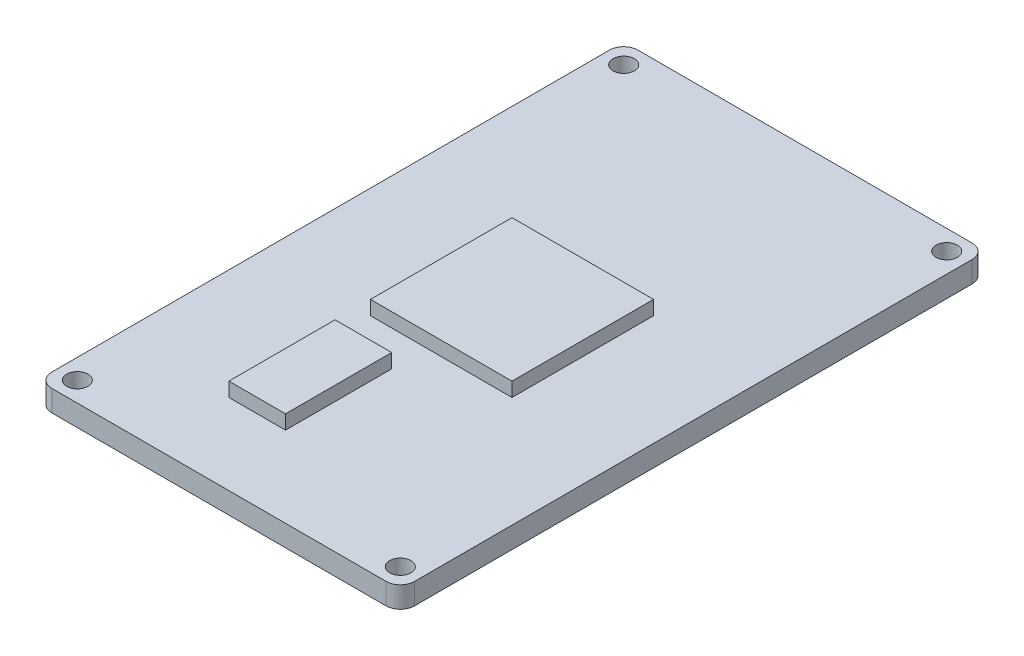
from build123d import *

# Parameters (mm, degrees)
SKETCH_1_W      = 51.24
SKETCH_1_H      = 82.8
SKETCH_1_R      = 1.5
EXTRUDE_1_DEPTH = 3
SKETCH_2_W      = 20
SKETCH_2_H      = 20
SKETCH_2_W_2    = 8
SKETCH_2_H_2    = 15
EXTRUDE_2_DEPTH = 2
FILLET_1_R      = 2


with BuildPart() as part:
    # 草图1 → 凸台-拉伸1 (new body)
    with BuildSketch(Plane(origin=(0, 0, 0), x_dir=(1, 0, 0), z_dir=(0, 1, 0))):
        Rectangle(SKETCH_1_W, SKETCH_1_H)
        with Locations(Location((22.82, 38.6, 0), (0, 0, 270))):
            Circle(SKETCH_1_R, mode=Mode.SUBTRACT)
        with Locations(Location((-22.82, 38.6, 0), (0, 0, 90))):
            Circle(SKETCH_1_R, mode=Mode.SUBTRACT)
        with Locations(Location((-22.82, -38.6, 0), (0, 0, 270))):
            Circle(SKETCH_1_R, mode=Mode.SUBTRACT)
        with Locations(Location((22.82, -38.6, 0), (0, 0, 90))):
            Circle(SKETCH_1_R, mode=Mode.SUBTRACT)
    extrude(amount=EXTRUDE_1_DEPTH)

    # 草图2 → 凸台-拉伸2 (add)
    with BuildSketch(Plane(origin=(0, 3, 0), x_dir=(1, 0, 0), z_dir=(0, 1, 0))):
        Rectangle(SKETCH_2_W, SKETCH_2_H)
        with Locations((-6, -22.5)):
            Rectangle(SKETCH_2_W_2, SKETCH_2_H_2)
    extrude(amount=EXTRUDE_2_DEPTH)

    # 圆角1
    fillet_1_edges = [part.edges().sort_by_distance(p)[0] for p in [
        (-25.62, 1.5, 41.4),
        (-25.62, 1.5, -41.4),
        (25.62, 1.5, -41.4),
        (25.62, 1.5, 41.4),
    ]]
    fillet(fillet_1_edges, radius=FILLET_1_R)


solid = part.part
